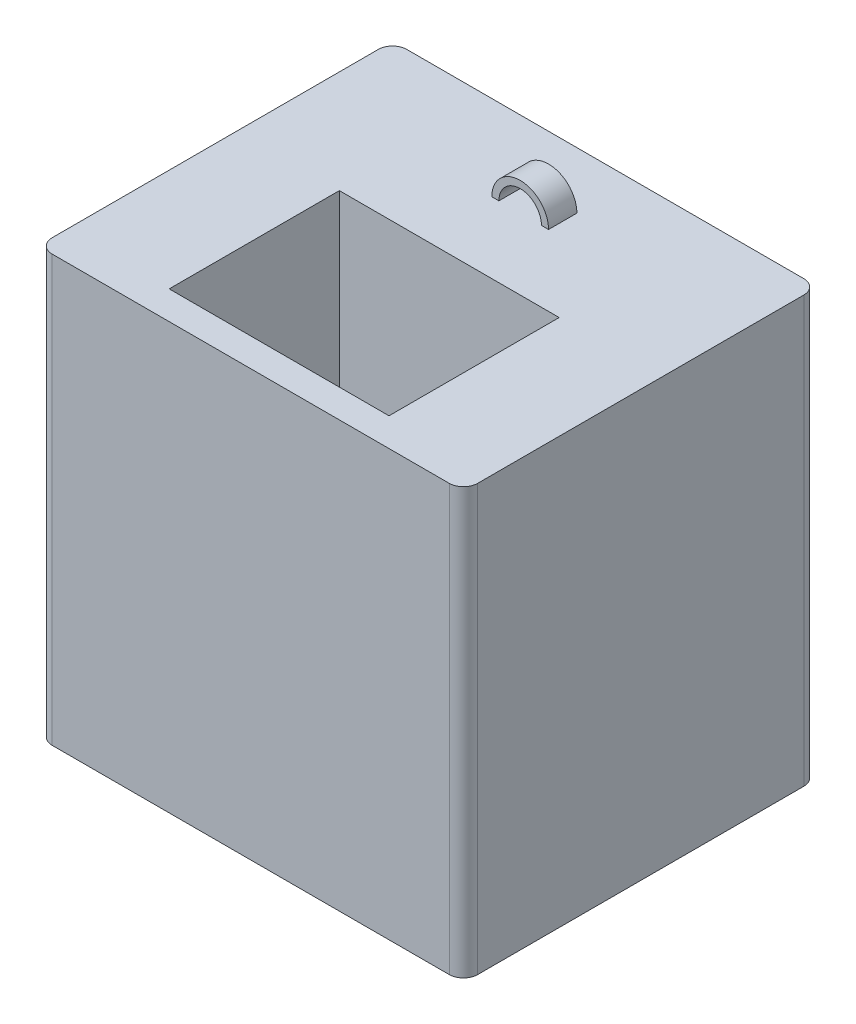
from build123d import *

# Parameters (mm, degrees)
SKETCH1_W           = 30
SKETCH1_H           = 25
BOSS_EXTRUDE1_DEPTH = 30
SKETCH2_W           = 15.5
SKETCH2_H           = 12
CUT_EXTRUDE1_DEPTH  = 30
FILLET1_R           = 1
BOSS_EXTRUDE2_DEPTH = 1


with BuildPart() as part:
    # Sketch1 → Boss-Extrude1 (new body)
    with BuildSketch(Plane(origin=(0, 0, 0), x_dir=(1, 0, 0), z_dir=(0, 1, 0))):
        Rectangle(SKETCH1_W, SKETCH1_H)
    extrude(amount=BOSS_EXTRUDE1_DEPTH)

    # Sketch2 → Cut-Extrude1 (cut)
    with BuildSketch(Plane(origin=(0, 30, 0), x_dir=(1, 0, 0), z_dir=(0, 1, 0))):
        with Locations((0, -4.5)):
            Rectangle(SKETCH2_W, SKETCH2_H)
    extrude(amount=-CUT_EXTRUDE1_DEPTH, mode=Mode.SUBTRACT)

    # Fillet1
    fillet1_edges = [part.edges().sort_by_distance(p)[0] for p in [
        (15, 15, 12.5),
        (-15, 15, 12.5),
        (-15, 15, -12.5),
        (15, 15, -12.5),
    ]]
    fillet(fillet1_edges, radius=FILLET1_R)

    # Sketch3 → Boss-Extrude2 (add, symmetric)
    with BuildSketch(Plane(origin=(0, 0, -7.5), x_dir=(-1, 0, 0), z_dir=(0, 0, -1))):
        with BuildLine():
            ThreePointArc((2, 30), (0, 32), (-2, 30))
            Line((-2, 30), (-1.5, 30))
            ThreePointArc((-1.5, 30), (0, 31.5), (1.5, 30))
            Line((1.5, 30), (2, 30))
        make_face()
    extrude(amount=BOSS_EXTRUDE2_DEPTH, both=True)


solid = part.part
